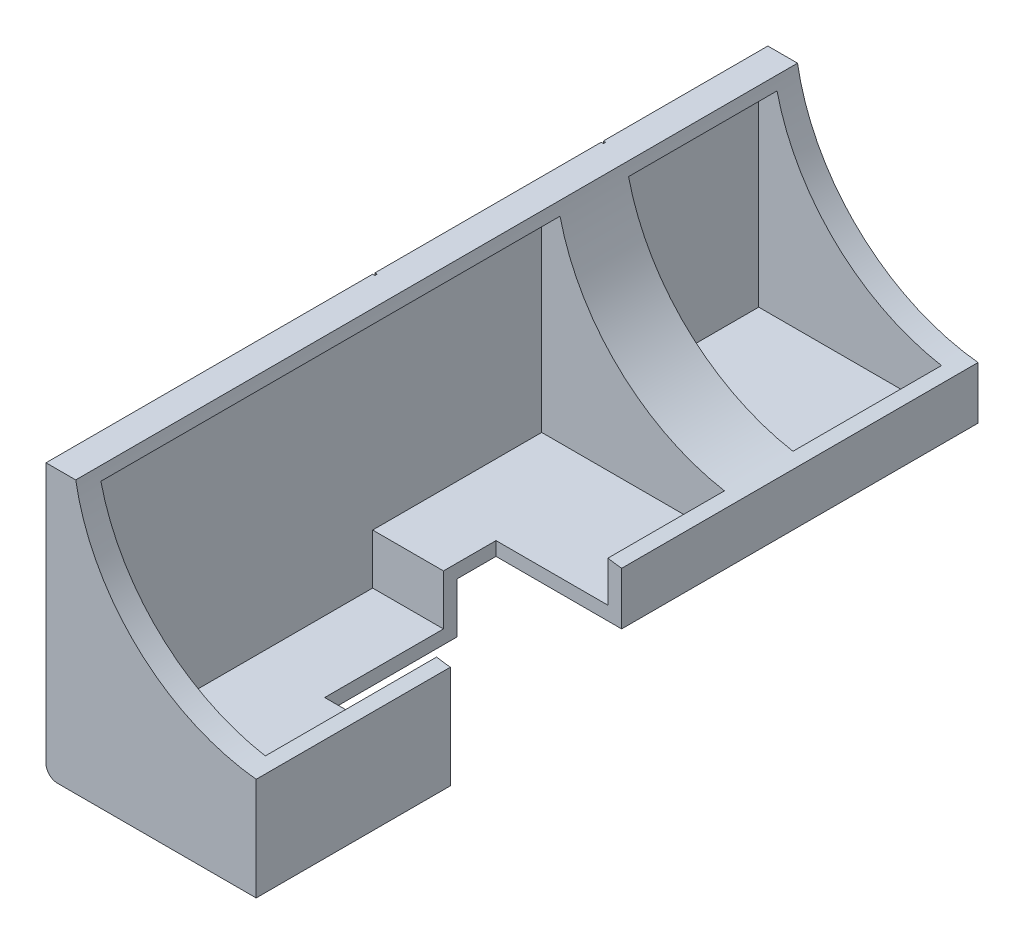
from build123d import *

# Parameters (mm, degrees)
BOSS_EXTRUDE1_DEPTH = 31.6
SKETCH4_W           = 12.7
SKETCH4_H           = 10
SKETCH4_W_2         = 8.3
SKETCH4_H_2         = 7.8
SKETCH4_W_3         = 5.8
SKETCH4_H_3         = 7.6
BOSS_EXTRUDE2_DEPTH = 0.35
FILLET1_R           = 0.5
SKETCH5_R           = 0.25
BOSS_EXTRUDE3_DEPTH = 0.1
SKETCH19_W          = 17.3
SKETCH19_H          = 2.2
CUT_EXTRUDE11_DEPTH = 36.553470936
FILLET2_R           = 0.5
SKETCH21_W          = 0.1
SKETCH21_H          = 9.7
CUT_EXTRUDE13_DEPTH = 0.1
SKETCH20_W          = 5.5
SKETCH20_H          = 7.5
CUT_EXTRUDE12_DEPTH = 36.945875479
SKETCH22_W          = 7.3
SKETCH22_H          = 12.7
CUT_EXTRUDE14_DEPTH = 11.3
SKETCH22_3_W        = 7.3
SKETCH22_3_H        = 7.4
SKETCH22_3_H_2      = 6.5
CUT_EXTRUDE15_DEPTH = 9.1
SKETCH23_W          = 6.5
SKETCH23_H          = 8.6
CUT_EXTRUDE16_DEPTH = 0.7
BOSS_EXTRUDE4_REACH = 37.07


with BuildPart() as part:
    # Sketch2 → Boss-Extrude1 (new body)
    with BuildSketch(Plane.XY):
        with BuildLine():
            Line((-0.965868705, -13.448021996), (-0.965868705, -8.948021996))
            ThreePointArc((-0.965868705, -8.948021996), (-6.152703888, -6.568427123), (-8.865868705, -1.548021996))
            Line((-8.865868705, -1.548021996), (-10.165868705, -1.548021996))
            Line((-10.165868705, -1.548021996), (-10.165868705, -13.448021996))
            Line((-10.165868705, -13.448021996), (-0.965868705, -13.448021996))
        make_face()
    extrude(amount=-BOSS_EXTRUDE1_DEPTH)

    # Sketch4 → Boss-Extrude2 (add)
    with BuildSketch(Plane.ZY.offset(10.165868705)):
        with Locations((-7.15, -7.248021996)):
            Rectangle(SKETCH4_W, SKETCH4_H)
        with Locations((-19.35, -6.148021996)):
            Rectangle(SKETCH4_W_2, SKETCH4_H_2)
        with Locations((-28.1, -6.048021996)):
            Rectangle(SKETCH4_W_3, SKETCH4_H_3)
    extrude(amount=BOSS_EXTRUDE2_DEPTH)

    # Fillet1
    fillet1_edges = [part.edges().sort_by_distance(p)[0] for p in [
        (-10.340868705, -2.248021996, -13.5),
        (-10.340868705, -12.248021996, -13.5),
        (-10.340868705, -12.248021996, -0.8),
        (-10.340868705, -2.248021996, -0.8),
        (-10.340868705, -2.248021996, -31),
        (-10.340868705, -9.848021996, -31),
        (-10.340868705, -9.848021996, -25.2),
        (-10.340868705, -2.248021996, -25.2),
        (-10.340868705, -2.248021996, -23.5),
        (-10.340868705, -10.048021996, -23.5),
        (-10.340868705, -10.048021996, -15.2),
        (-10.340868705, -2.248021996, -15.2),
    ]]
    fillet(fillet1_edges, radius=FILLET1_R)

    # Sketch5 → Boss-Extrude3 (add)
    with BuildSketch(Plane.ZY.offset(10.515868705)):
        with Locations(Location((-13, -2.748021996, 0), (0, 0, 180))):
            Circle(SKETCH5_R)
        with Locations(Location((-1.3, -2.748021996, 0), (0, 0, 180))):
            Circle(SKETCH5_R)
        with Locations((-23, -2.748021996)):
            Circle(SKETCH5_R)
        with Locations((-23, -9.548021996)):
            Circle(SKETCH5_R)
        with Locations(Location((-1.3, -11.748021996, 0), (0, 0, 180))):
            Circle(SKETCH5_R)
        with Locations(Location((-13, -11.748021996, 0), (0, 0, 180))):
            Circle(SKETCH5_R)
        with Locations((-15.7, -2.748021996)):
            Circle(SKETCH5_R)
        with Locations((-15.7, -9.548021996)):
            Circle(SKETCH5_R)
        with Locations((-30.5, -2.748021996)):
            Circle(SKETCH5_R)
        with Locations((-25.7, -2.748021996)):
            Circle(SKETCH5_R)
        with Locations((-25.7, -9.348021996)):
            Circle(SKETCH5_R)
        with Locations((-30.5, -9.348021996)):
            Circle(SKETCH5_R)
    extrude(amount=BOSS_EXTRUDE3_DEPTH)

    # Sketch19 → Cut-Extrude11 (cut, through all)
    with BuildSketch(Plane.ZY.offset(10.165868705)):
        with Locations((-22.95, -12.348021996)):
            Rectangle(SKETCH19_W, SKETCH19_H)
    extrude(amount=-CUT_EXTRUDE11_DEPTH, mode=Mode.SUBTRACT)

    # Fillet2
    fillet2_edges = [part.edges().sort_by_distance(p)[0] for p in [
        (-10.165868705, -13.448021996, -7.15),
        (-10.165868705, -11.248021996, -22.95),
    ]]
    fillet(fillet2_edges, radius=FILLET2_R)

    # Sketch21 → Cut-Extrude13 (cut)
    with BuildSketch(Plane.ZY.offset(10.165868705)):
        with Locations((-14.35, -6.398021996)):
            Rectangle(SKETCH21_W, SKETCH21_H)
        with Locations((-24.35, -6.398021996)):
            Rectangle(SKETCH21_W, SKETCH21_H)
    extrude(amount=-CUT_EXTRUDE13_DEPTH, mode=Mode.SUBTRACT)

    # Sketch20 → Cut-Extrude12 (cut, through all)
    with BuildSketch(Plane(origin=(0, 0, 0), x_dir=(1, 0, 0), z_dir=(0, 1, 0))):
        with Locations((-3.715868705, 12.25)):
            Rectangle(SKETCH20_W, SKETCH20_H)
    extrude(amount=-CUT_EXTRUDE12_DEPTH, mode=Mode.SUBTRACT)

    # Sketch22 → Cut-Extrude14 (cut)
    with BuildSketch(Plane(origin=(0, -1.548021996, 0), x_dir=(1, 0, 0), z_dir=(0, 1, 0))):
        with Locations((-5.215868705, 7.35)):
            Rectangle(SKETCH22_W, SKETCH22_H)
    extrude(amount=-CUT_EXTRUDE14_DEPTH, mode=Mode.SUBTRACT)

    # Sketch22<3> → Cut-Extrude15 (cut)
    with BuildSketch(Plane(origin=(0, -1.548021996, 0), x_dir=(1, 0, 0), z_dir=(0, 1, 0))):
        with Locations((-5.215868705, 17.4)):
            Rectangle(SKETCH22_3_W, SKETCH22_3_H)
        with Locations((-5.215868705, 27.35)):
            Rectangle(SKETCH22_3_W, SKETCH22_3_H_2)
    extrude(amount=-CUT_EXTRUDE15_DEPTH, mode=Mode.SUBTRACT)

    # Sketch23 → Cut-Extrude16 (cut)
    with BuildSketch(Plane(origin=(-8.865868705, 0, 0), x_dir=(0, 0, -1), z_dir=(1, 0, 0))):
        Polygon((1, -12.848021996), (13.7, -12.848021996), (13.7, -10.648021996), (21.1, -10.648021996), (21.1, -2.048021996), (1, -2.048021996), align=None)
        with Locations((27.35, -6.348021996)):
            Rectangle(SKETCH23_W, SKETCH23_H)
    extrude(amount=-CUT_EXTRUDE16_DEPTH, mode=Mode.SUBTRACT)

    # Sketch24 → Boss-Extrude4 (add, up to next)
    with BuildSketch(Plane(origin=(0, 0, -1), x_dir=(-1, 0, 0), z_dir=(0, 0, -1)), mode=Mode.PRIVATE) as boss_extrude4_sk1:
        with BuildLine():
            Line((8.865868705, -2.048021996), (8.865868705, -1.548021996))
            ThreePointArc((8.865868705, -1.548021996), (8.818419162, -1.798744975), (8.763880756, -2.048021996))
            Line((8.763880756, -2.048021996), (8.865868705, -2.048021996))
        make_face()
    boss_extrude4_tool1 = extrude(boss_extrude4_sk1.sketch, amount=BOSS_EXTRUDE4_REACH, mode=Mode.PRIVATE) - part.part
    add(boss_extrude4_tool1.solids().sort_by_distance((-8.832663, -1.885567, -1))[0])
    add(boss_extrude4_tool1.solids().sort_by_distance((-8.832663, -1.885567, -1))[1])


solid = part.part
